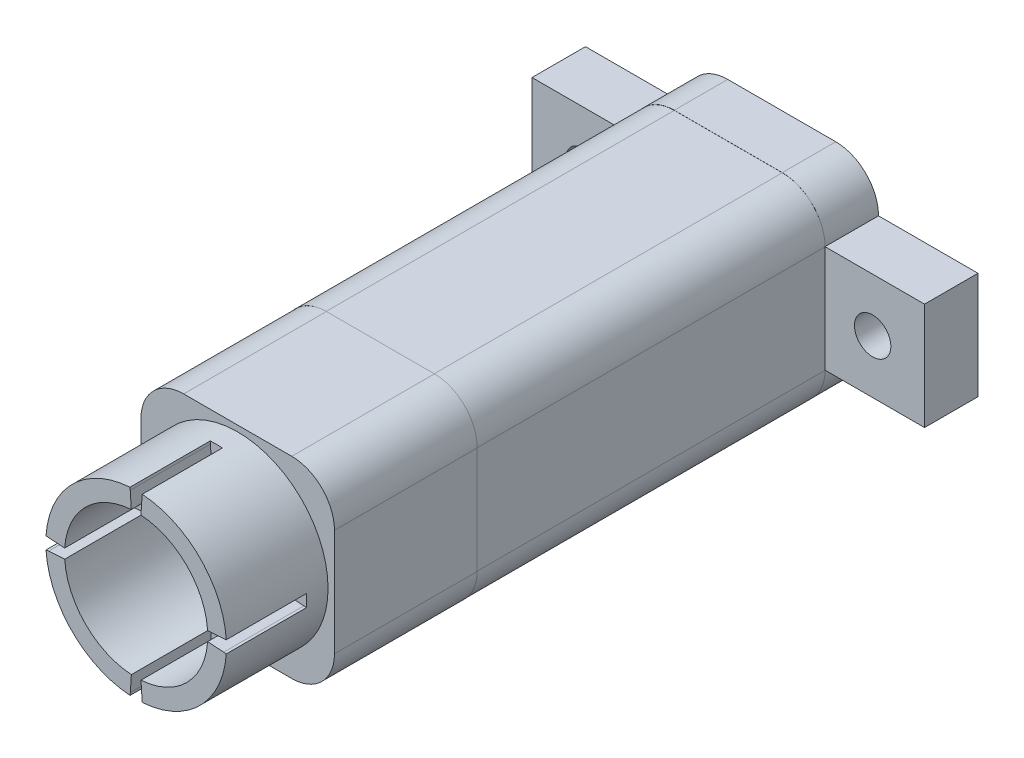
from build123d import *

# Parameters (mm, degrees)
BOSS_EXTRUDE1_DEPTH = 2
BOSS_EXTRUDE2_DEPTH = 11.74993
BOSS_EXTRUDE3_DEPTH = 1.6
SKETCH4_R           = 8.45
BOSS_EXTRUDE4_DEPTH = 9.5
SKETCH5_R           = 6.65
CUT_EXTRUDE1_DEPTH  = 20
BOSS_EXTRUDE5_DEPTH = 32.56
SKETCH13_R          = 6.7
CUT_EXTRUDE3_DEPTH  = 30
CUT_EXTRUDE4_DEPTH  = 7.5
CIRPATTERN2_COUNT   = 4
SKETCH16_R          = 1.7
BOSS_EXTRUDE6_DEPTH = 5


with BuildPart() as part:
    # Sketch1 → Boss-Extrude1 (new body)
    with BuildSketch(Plane.XY):
        with BuildLine():
            Line((-5.05, 9.000108401), (5.05, 9.000108401))
            ThreePointArc((5.05, 9.000108401), (7.878427125, 7.828535526), (9.05, 5.000108401))
            Line((9.05, 5.000108401), (9.05, -5.000108401))
            ThreePointArc((9.05, -5.000108401), (7.878427125, -7.828535526), (5.05, -9.000108401))
            Line((5.05, -9.000108401), (-5.05, -9.000108401))
            ThreePointArc((-5.05, -9.000108401), (-7.878427125, -7.828535526), (-9.05, -5.000108401))
            Line((-9.05, -5.000108401), (-9.05, 5.000108401))
            ThreePointArc((-9.05, 5.000108401), (-7.878427125, 7.828535526), (-5.05, 9.000108401))
        make_face()
    extrude(amount=BOSS_EXTRUDE1_DEPTH)

    # Sketch2 → Boss-Extrude2 (add)
    with BuildSketch(Plane.XY):
        with BuildLine():
            Line((-5.05, 9.000108401), (5.05, 9.000108401))
            ThreePointArc((5.05, 9.000108401), (7.878427125, 7.828535526), (9.05, 5.000108401))
            Line((9.05, 5.000108401), (9.05, -5.000108401))
            ThreePointArc((9.05, -5.000108401), (7.878427125, -7.828535526), (5.05, -9.000108401))
            Line((5.05, -9.000108401), (-5.05, -9.000108401))
            ThreePointArc((-5.05, -9.000108401), (-7.878427125, -7.828535526), (-9.05, -5.000108401))
            Line((-9.05, -5.000108401), (-9.05, 5.000108401))
            ThreePointArc((-9.05, 5.000108401), (-7.878427125, 7.828535526), (-5.05, 9.000108401))
        make_face()
    extrude(amount=BOSS_EXTRUDE2_DEPTH)

    # Sketch3 → Boss-Extrude3 (add)
    with BuildSketch(Plane.XY.offset(11.74993)):
        with BuildLine():
            Line((-5.05, 9.000108401), (5.05, 9.000108401))
            ThreePointArc((5.05, 9.000108401), (7.878427125, 7.828535526), (9.05, 5.000108401))
            Line((9.05, 5.000108401), (9.05, -5.000108401))
            ThreePointArc((9.05, -5.000108401), (7.878427125, -7.828535526), (5.05, -9.000108401))
            Line((5.05, -9.000108401), (-5.05, -9.000108401))
            ThreePointArc((-5.05, -9.000108401), (-7.878427125, -7.828535526), (-9.05, -5.000108401))
            Line((-9.05, -5.000108401), (-9.05, 5.000108401))
            ThreePointArc((-9.05, 5.000108401), (-7.878427125, 7.828535526), (-5.05, 9.000108401))
        make_face()
    extrude(amount=BOSS_EXTRUDE3_DEPTH)

    # Sketch4 → Boss-Extrude4 (add)
    with BuildSketch(Plane.XY.offset(13.34993)):
        Circle(SKETCH4_R)
    extrude(amount=BOSS_EXTRUDE4_DEPTH)

    # Sketch5 → Cut-Extrude1 (cut)
    with BuildSketch(Plane.XY.offset(13.34993)):
        Circle(SKETCH5_R)
    extrude(amount=CUT_EXTRUDE1_DEPTH, mode=Mode.SUBTRACT)

    # Sketch12 → Boss-Extrude5 (add)
    with BuildSketch(Plane(origin=(0, 0, 0), x_dir=(-1, 0, 0), z_dir=(0, 0, -1))):
        with BuildLine():
            Line((-5.027404416, 8.997340309), (5.072595584, 8.997340309))
            ThreePointArc((5.072595584, 8.997340309), (7.901022709, 7.825767433), (9.072595584, 4.997340309))
            Line((9.072595584, 4.997340309), (9.072595584, -5.002876493))
            ThreePointArc((9.072595584, -5.002876493), (7.901022709, -7.831303618), (5.072595584, -9.002876493))
            Line((5.072595584, -9.002876493), (-5.027404416, -9.002876493))
            ThreePointArc((-5.027404416, -9.002876493), (-7.85583154, -7.831303618), (-9.027404416, -5.002876493))
            Line((-9.027404416, -5.002876493), (-9.027404416, 4.997340309))
            ThreePointArc((-9.027404416, 4.997340309), (-7.85583154, 7.825767433), (-5.027404416, 8.997340309))
        make_face()
    extrude(amount=BOSS_EXTRUDE5_DEPTH)

    # Sketch13 → Cut-Extrude3 (cut, symmetric)
    with BuildSketch(Plane.XY):
        Circle(SKETCH13_R)
    extrude(amount=CUT_EXTRUDE3_DEPTH, both=True, mode=Mode.SUBTRACT)

    # Sketch15 → Cut-Extrude4 (cut)
    with BuildSketch(Plane.XY.offset(22.84993)):
        Polygon((-0.552830798, 8.187091014), (-0.002830798, 0.003314653), (0.547169202, 8.187091014), (0.617169202, 9.000108401), (-0.626042329, 9.000108401), align=None)
    cut_extrude4 = extrude(amount=-CUT_EXTRUDE4_DEPTH, mode=Mode.SUBTRACT)

    # CirPattern2: Cut-Extrude4 ×4 about axis
    cirpattern2_axis = Axis((0, 0, 0), (0, 0, 1))
    for i in range(1, CIRPATTERN2_COUNT):
        add(cut_extrude4.rotate(cirpattern2_axis, i * 360 / CIRPATTERN2_COUNT), mode=Mode.SUBTRACT)


with BuildPart() as body_2:
    # Sketch16 → Boss-Extrude6 (new body)
    with BuildSketch(Plane(origin=(0, 0, -32.56), x_dir=(-1, 0, 0), z_dir=(0, 0, -1))):
        with BuildLine():
            Line((-5.023439618, 9.008375808), (5.076560382, 9.008375808))
            ThreePointArc((5.076560382, 9.008375808), (7.904987507, 7.836802933), (9.076560382, 5.008375808))
            Line((9.076560382, 5.008375808), (18.383296185, 5.008375808))
            Line((18.383296185, 5.008375808), (18.383296185, -4.991840993))
            Line((18.383296185, -4.991840993), (9.076560382, -4.991840993))
            ThreePointArc((9.076560382, -4.991840993), (7.904987507, -7.820268118), (5.076560382, -8.991840993))
            Line((5.076560382, -8.991840993), (-5.023439618, -8.991840993))
            ThreePointArc((-5.023439618, -8.991840993), (-7.851866743, -7.820268118), (-9.023439618, -4.991840993))
            Line((-9.023439618, -4.991840993), (-18.330175421, -4.991840993))
            Line((-18.330175421, -4.991840993), (-18.330175421, 5.008375808))
            Line((-18.330175421, 5.008375808), (-9.023439618, 5.008375808))
            ThreePointArc((-9.023439618, 5.008375808), (-7.851866743, 7.836802933), (-5.023439618, 9.008375808))
        make_face()
        with Locations((-13.477242349, 0.008267407)):
            Circle(SKETCH16_R, mode=Mode.SUBTRACT)
        with Locations(Location((13.530363113, 0.008267407, 0), (0, 0, 180))):
            Circle(SKETCH16_R, mode=Mode.SUBTRACT)
    extrude(amount=BOSS_EXTRUDE6_DEPTH)


solid = Compound([part.part, body_2.part])
